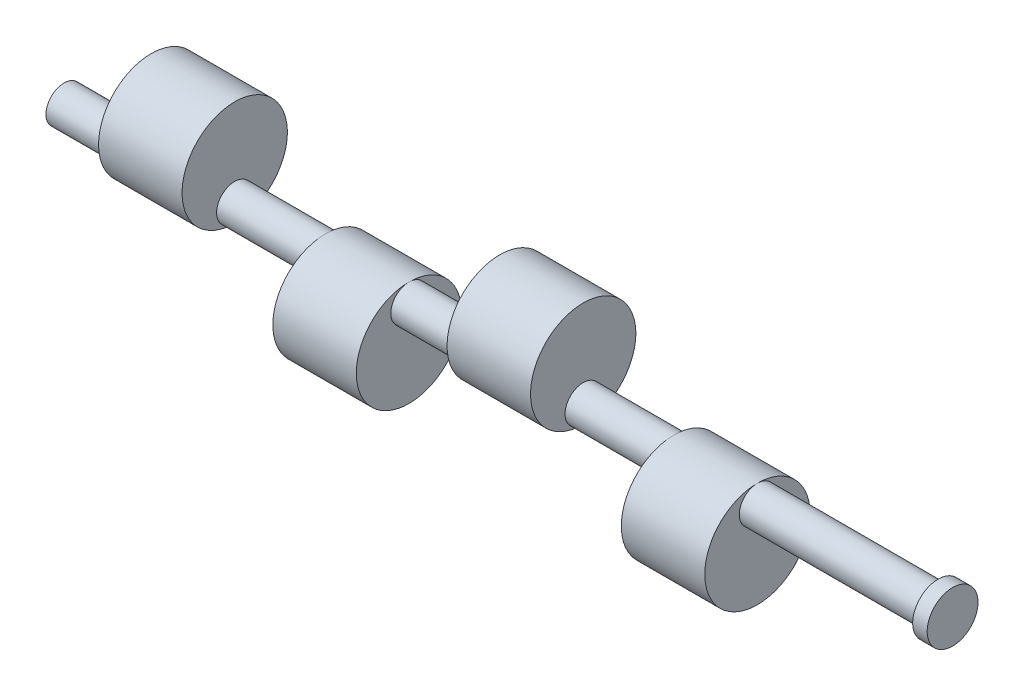
from build123d import *

# Parameters (mm, degrees)
SKETCH_1_W          = 264.89
SKETCH_1_H          = 5
SKETCH_2_R          = 14.5
EXTRUDE_1_DEPTH     = 23
SKETCH_3_R          = 14.5
EXTRUDE_2_DEPTH     = 23
SKETCH_4_R          = 14.5
EXTRUDE_3_DEPTH     = 23
SKETCH_5_R          = 14.5
EXTRUDE_4_DEPTH     = 23
SKETCH_7_R          = 5
CUT_EXTRUDE_1_DEPTH = 20.12
SKETCH_8_R          = 7
EXTRUDE_6_DEPTH     = 4


with BuildPart() as part:
    # 草圖1 → 旋轉1 (revolve)
    with BuildSketch(Plane.XY, mode=Mode.PRIVATE) as revolve_1_sk:
        with Locations((-132.445, 2.5)):
            Rectangle(SKETCH_1_W, SKETCH_1_H)
    revolve(revolve_1_sk.sketch.rotate(Axis((0, 0, 0), (-1, 0, 0)), 90), axis=Axis((0, 0, 0), (-1, 0, 0)))

    # 草圖2 → 填料-伸長1 (add)
    with BuildSketch(Plane.ZY.offset(240.89)):
        with Locations(Location((0, 9.5, 0), (0, 0, 270))):
            Circle(SKETCH_2_R)
    extrude(amount=-EXTRUDE_1_DEPTH)

    # 草圖3 → 填料-伸長2 (add)
    with BuildSketch(Plane.ZY.offset(192.89)):
        with Locations(Location((0, -9.5, 0), (0, 0, 90))):
            Circle(SKETCH_3_R)
    extrude(amount=-EXTRUDE_2_DEPTH)

    # 草圖4 → 填料-伸長3 (add)
    with BuildSketch(Plane.ZY.offset(144.89)):
        with Locations(Location((0, 9.5, 0), (0, 0, 270))):
            Circle(SKETCH_4_R)
    extrude(amount=-EXTRUDE_3_DEPTH)

    # 草圖5 → 填料-伸長4 (add)
    with BuildSketch(Plane.ZY.offset(96.89)):
        with Locations(Location((0, -9.5, 0), (0, 0, 90))):
            Circle(SKETCH_5_R)
    extrude(amount=-EXTRUDE_4_DEPTH)

    # 草圖7 → 除料-伸長1 (cut)
    with BuildSketch(Plane(origin=(0, 0, 0), x_dir=(0, 0, -1), z_dir=(1, 0, 0))):
        Circle(SKETCH_7_R)
    extrude(amount=-CUT_EXTRUDE_1_DEPTH, mode=Mode.SUBTRACT)

    # 草圖8 → 填料-伸長6 (add)
    with BuildSketch(Plane(origin=(-20.12, 0, 0), x_dir=(0, 0, -1), z_dir=(1, 0, 0))):
        Circle(SKETCH_8_R)
    extrude(amount=-EXTRUDE_6_DEPTH)


solid = part.part
